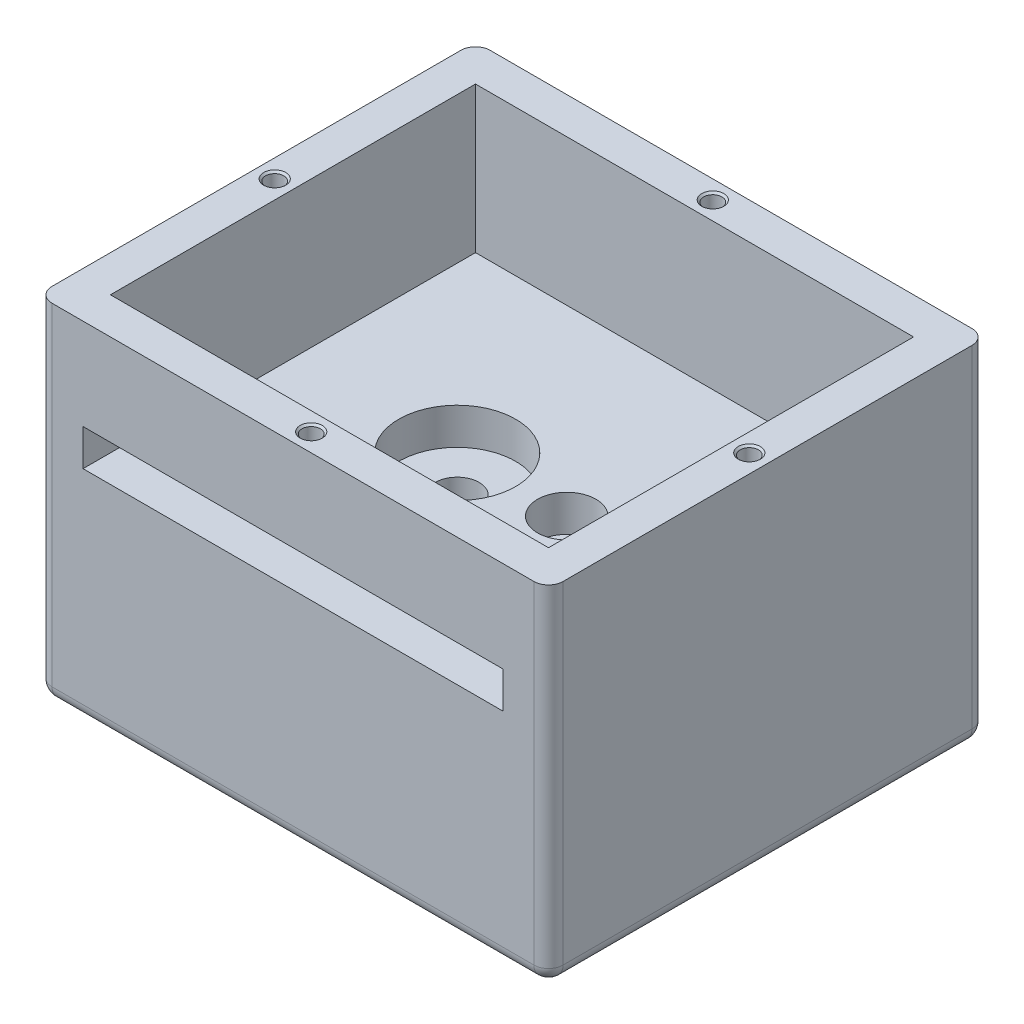
from build123d import *

# Parameters (mm, degrees)
BOX_EXTRUDE_PART_DEPTH         = 80
BOX_EXTRUDE_PART_DEPTH_BACK    = 15
BOX_TOP_VIEW_W                 = 140
BOX_TOP_VIEW_H                 = 120
INNER_BOX_CUT_W                = 120
INNER_BOX_CUT_H                = 100
INNER_BOX_CUT_1_DEPTH          = 40
SCISSOR_CROSSSECTION_W         = 115
SCISSOR_CROSSSECTION_H         = 10
SCISSOR_CORSSSECTION_CUT_DEPTH = 10
SHAFT_LOCATION_R               = 6
SHAFT_LOCATION_CUT_DEPTH       = 40
SKETCH2_R                      = 16
SKETCH2_R_2                    = 8
BEARING_LOCATION_CUT1_DEPTH    = 10
M6_TAPPED_HOLE3_AT_2_COUNT     = 2
M6_TAPPED_HOLE3_AT_2_PITCH     = 85.14693183
EDGES_FILLET_R                 = 4


with BuildPart() as part:
    # Box_top_view → Box_extrude_part (new, two sides: drawn at the far end of the back side and taken through both)
    with BuildSketch(Plane(origin=(0, 0, 0), x_dir=(1, 0, 0), z_dir=(0, 1, 0)).offset(-BOX_EXTRUDE_PART_DEPTH_BACK)):
        Rectangle(BOX_TOP_VIEW_W, BOX_TOP_VIEW_H)
    extrude(amount=BOX_EXTRUDE_PART_DEPTH + BOX_EXTRUDE_PART_DEPTH_BACK)

    # Inner_box_cut → Inner_box_cut_1 (cut)
    with BuildSketch(Plane(origin=(0, 80, 0), x_dir=(1, 0, 0), z_dir=(0, 1, 0))):
        Rectangle(INNER_BOX_CUT_W, INNER_BOX_CUT_H)
    extrude(amount=-INNER_BOX_CUT_1_DEPTH, mode=Mode.SUBTRACT)

    # Scissor_crossSection → Scissor_corssSection_cut (cut)
    with BuildSketch(Plane.XY.offset(60)):
        with Locations((0, 50)):
            Rectangle(SCISSOR_CROSSSECTION_W, SCISSOR_CROSSSECTION_H)
    extrude(amount=-SCISSOR_CORSSSECTION_CUT_DEPTH, mode=Mode.SUBTRACT)

    # Shaft_location → Shaft_location_cut (cut)
    with BuildSketch(Plane(origin=(0, 40, 0), x_dir=(1, 0, 0), z_dir=(0, 1, 0))):
        with Locations(Location((15, 0, 0), (0, 0, 270))):
            Circle(SHAFT_LOCATION_R)
        with Locations(Location((-15, 0, 0), (0, 0, 90))):
            Circle(SHAFT_LOCATION_R)
    extrude(amount=-SHAFT_LOCATION_CUT_DEPTH, mode=Mode.SUBTRACT)

    # Sketch2 → Bearing_location_cut1 (cut)
    with BuildSketch(Plane(origin=(0, 40, 0), x_dir=(1, 0, 0), z_dir=(0, 1, 0))):
        with Locations(Location((-15, 0, 0), (0, 0, 270))):
            Circle(SKETCH2_R)
        with Locations(Location((15, 0, 0), (0, 0, 90))):
            Circle(SKETCH2_R_2)
    extrude(amount=-BEARING_LOCATION_CUT1_DEPTH, mode=Mode.SUBTRACT)

    # Sketch7 → M6 Tapped Hole3 (revolve, cut)
    with BuildSketch(Plane(origin=(0, 80, -55), x_dir=(0, 0, 1), z_dir=(1, 0, 0))):
        Polygon((0, 0), (0, 14.502151548), (2.5, 13), (2.5, 0.525), (3.025, 0), align=None)
    m6_tapped_hole3 = revolve(axis=Axis((0, 86.35, -55), (0, -1, 0)), mode=Mode.SUBTRACT)

    # M6 Tapped Hole3 at 2: M6 Tapped Hole3 ×2
    with Locations(*[Vector(-0.7633862853691146, 0, 0.645942241466174) * (i * M6_TAPPED_HOLE3_AT_2_PITCH) for i in range(1, M6_TAPPED_HOLE3_AT_2_COUNT)]):
        add(m6_tapped_hole3, mode=Mode.SUBTRACT)

    # M6_hole_mirror: M6 Tapped Hole3 across plane
    add(m6_tapped_hole3.mirror(Plane(origin=(0, 0, 0), x_dir=(0, 0, 1), z_dir=(1, 0, 0))), mode=Mode.SUBTRACT)

    # M6_hole_mirror copy 1 sketch → M6_hole_mirror copy 1 (revolve, cut)
    with BuildSketch(Plane(origin=(65, 80, 0), x_dir=(0, 0, 1), z_dir=(-1, 0, 0))):
        Polygon((0, 0), (0, -14.502151548), (2.5, -13), (2.5, -0.525), (3.025, 0), align=None)
    revolve(axis=Axis((65, 86.35, 0), (0, 1, 0)), mode=Mode.SUBTRACT)

    # M6_hole_mirror at the second plane: M6 Tapped Hole3 across plane
    add(m6_tapped_hole3.mirror(Plane.XY), mode=Mode.SUBTRACT)

    # M6_hole_mirror at the second plane copy → M6_hole_mirror at the second plane c 2 (revolve, cut)
    with BuildSketch(Plane(origin=(-65, 80, 0), x_dir=(0, 0, -1), z_dir=(1, 0, 0))):
        Polygon((0, 0), (0, -14.502151548), (2.5, -13), (2.5, -0.525), (3.025, 0), align=None)
    revolve(axis=Axis((-65, 86.35, 0), (0, 1, 0)), mode=Mode.SUBTRACT)

    # Edges_fillet
    edges_fillet_edges = [part.edges().sort_by_distance(p)[0] for p in [
        (70, -15, 0),
        (0, -15, -60),
        (-70, -15, 0),
        (-70, 32.5, -60),
        (70, 32.5, -60),
        (70, 32.5, 60),
        (-70, 32.5, 60),
        (0, -15, 60),
    ]]
    fillet(edges_fillet_edges, radius=EDGES_FILLET_R)


solid = part.part
